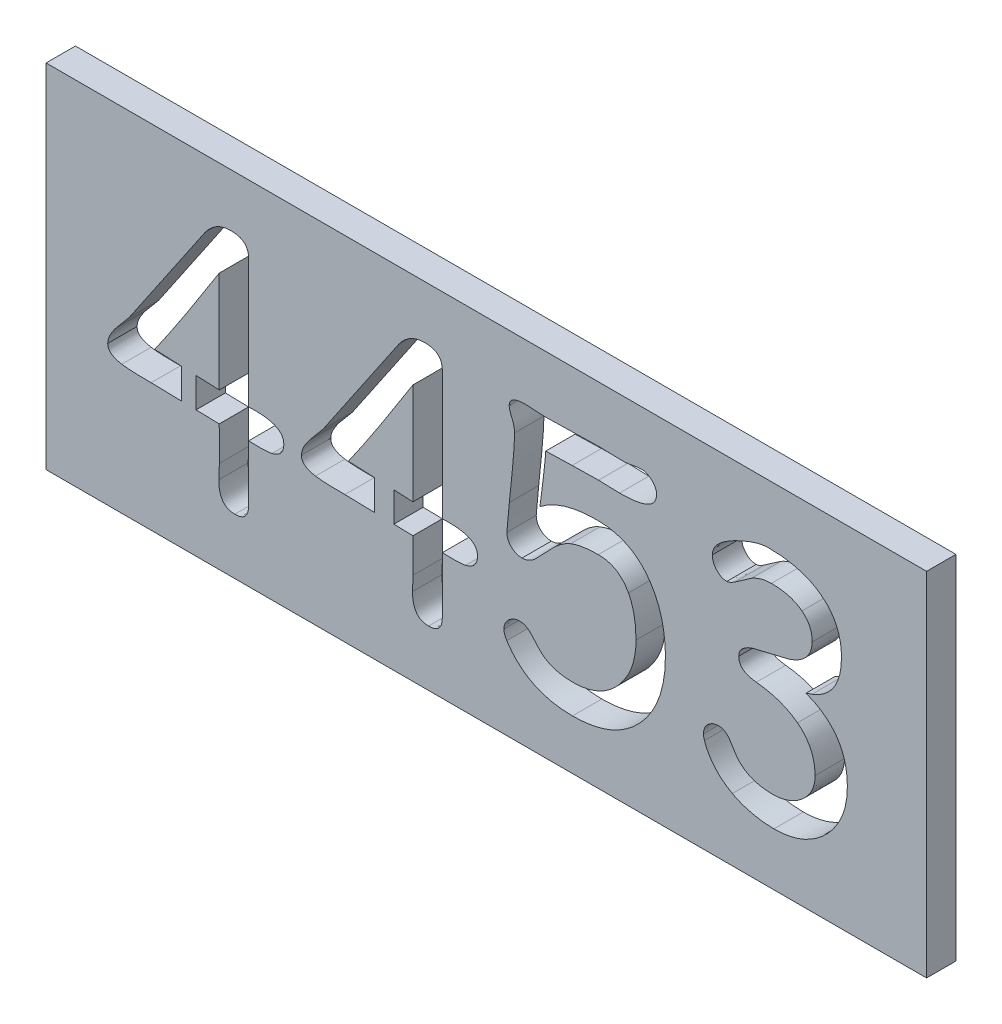
from build123d import *

# Parameters (mm, degrees)
SKETCH1_W           = 381
SKETCH1_H           = 152.4
BOSS_EXTRUDE1_DEPTH = 12.7
CUT_EXTRUDE1_DEPTH  = 206.567458514
SKETCH3_W           = 6.248362769
SKETCH3_H           = 26.243123629
SKETCH3_W_2         = 8.331150358
SKETCH3_H_2         = 23.952057281
BOSS_EXTRUDE2_DEPTH = 12.7


with BuildPart() as part:
    # Sketch1 → Boss-Extrude1 (new body)
    with BuildSketch(Plane.XY):
        Rectangle(SKETCH1_W, SKETCH1_H)
    extrude(amount=BOSS_EXTRUDE1_DEPTH)

    # Sketch2 → Cut-Extrude1 (cut, through all)
    # profile 1 of 4: a face of its own
    with BuildSketch(Plane.XY.offset(12.7)):
        with BuildLine():
            Line((-102.87, -21.59), (-102.87, -45.93828125))
            add(Edge.make_bspline(
                [(-102.87, -45.93828125), (-102.888344799, -46.416049339), (-102.923093354, -47.321033384), (-103.198056206, -48.585228637), (-103.653980481, -49.675352894), (-104.32141726, -50.568425378), (-105.184725762, -51.269670187), (-106.245057771, -51.742299275), (-107.479799736, -52.016543625), (-108.358597941, -52.051514579), (-108.823125, -52.07)],
                knots=[0, 0, 0, 0, 1.169846186, 2.215912189, 3.152384091, 4.043869571, 4.919746346, 5.848046681, 6.862491365, 8, 8, 8, 8], degree=3))
            add(Edge.make_bspline(
                [(-108.823125, -52.07), (-109.369634506, -52.050603363), (-110.411747987, -52.013616822), (-111.856935325, -51.534692006), (-113.097569763, -50.789237189), (-114.089982112, -49.707421831), (-114.877130788, -48.349951939), (-115.383900807, -46.687651711), (-115.735987805, -44.7558892), (-115.757129459, -43.367163204), (-115.7684375, -42.624375)],
                knots=[0, 0, 0, 0, 0.979258328, 1.867302019, 2.706068824, 3.55623654, 4.478688954, 5.505929839, 6.665996101, 8, 8, 8, 8], degree=3))
            add(Edge.make_bspline(
                [(-115.7684375, -42.624375), (-115.755752963, -42.154735109), (-115.725909429, -41.049790191), (-115.675365395, -39.613746124), (-115.586006208, -38.371727719), (-115.56195878, -37.550444767), (-115.502375478, -36.903438376), (-115.508042662, -36.532423173), (-115.51046875, -36.37359375)],
                knots=[0, 0, 0, 0, 1.351581217, 3.17993174, 4.133083147, 4.933198664, 5.543308631, 6, 6, 6, 6], degree=3))
            Line((-115.51046875, -36.37359375), (-115.57, -21.59))
            Line((-115.57, -21.59), (-145.03796875, -20.89546875))
            add(Edge.make_bspline(
                [(-145.03796875, -20.89546875), (-145.772229691, -20.899572244), (-147.181346594, -20.907447241), (-149.211738883, -20.853448163), (-151.064243465, -20.8239181), (-152.744490833, -20.762438299), (-154.239943117, -20.687405476), (-155.563053817, -20.586749163), (-156.709001538, -20.475577676), (-157.414193595, -20.368954122), (-157.73796875, -20.32)],
                knots=[0, 0, 0, 0, 1.384912504, 2.657779423, 3.830853642, 4.879563718, 5.829104526, 6.654925644, 7.382435391, 8, 8, 8, 8], degree=3))
            add(Edge.make_bspline(
                [(-157.73796875, -20.32), (-158.216195977, -20.22958258), (-159.116079712, -20.059443449), (-160.364446995, -19.684980451), (-161.421916196, -19.215300007), (-162.29436807, -18.654414545), (-162.988034143, -18.018906003), (-163.487780396, -17.28147435), (-163.7712078, -16.443708513), (-163.810116779, -15.857211187), (-163.83, -15.5575)],
                knots=[0, 0, 0, 0, 1.379706499, 2.596203994, 3.68766332, 4.650280589, 5.526184501, 6.337857579, 7.1506139, 8, 8, 8, 8], degree=3))
            add(Edge.make_bspline(
                [(-163.83, -15.5575), (-163.773638154, -15.016498201), (-163.650410699, -13.833671895), (-162.900097756, -11.99954138), (-161.738958862, -9.984005898), (-160.724740975, -8.640769858), (-160.17875, -7.91765625)],
                knots=[0, 0, 0, 0, 0.756102799, 1.65311517, 2.736585152, 4, 4, 4, 4], degree=3))
            Line((-160.17875, -7.91765625), (-154.44390625, -1.0715625))
            Line((-154.44390625, -1.0715625), (-121.70171875, 47.1090625))
            add(Edge.make_bspline(
                [(-121.70171875, 47.1090625), (-121.329799964, 47.608349325), (-120.608233302, 48.577025126), (-119.355010457, 49.836022956), (-118.04271514, 50.909252811), (-116.673005056, 51.822593898), (-115.204585433, 52.501380685), (-113.661314041, 52.973376218), (-112.050288449, 53.28567398), (-110.947859517, 53.321763354), (-110.39078125, 53.34)],
                knots=[0, 0, 0, 0, 1.10976452, 2.153075109, 3.1596165, 4.1319419, 5.082458473, 6.034439633, 7.006765033, 8, 8, 8, 8], degree=3))
            add(Edge.make_bspline(
                [(-110.39078125, 53.34), (-109.800277257, 53.32568963), (-108.688796431, 53.298753824), (-107.140763851, 52.977950971), (-105.818240538, 52.471041305), (-104.734627079, 51.736919473), (-103.862248789, 50.806955891), (-103.295532244, 49.628756332), (-102.924069476, 48.269343799), (-102.888729814, 47.290500143), (-102.87, 46.77171875)],
                knots=[0, 0, 0, 0, 1.238680683, 2.33151654, 3.304325217, 4.194636066, 5.060203577, 5.948886303, 6.912921778, 8, 8, 8, 8], degree=3))
            Line((-102.87, 46.77171875), (-102.87, -8.89))
            add(Edge.make_bspline(
                [(-102.87, -8.89), (-102.446705531, -8.875020337), (-101.520950652, -8.842259463), (-100.594638095, -8.834616841), (-100.091875, -8.83046875)],
                knots=[0, 0, 0, 0, 0.914484986, 2, 2, 2, 2], degree=3))
            add(Edge.make_bspline(
                [(-100.091875, -8.83046875), (-99.118903193, -8.84784629), (-97.293413328, -8.880450033), (-94.742391547, -9.158648091), (-92.58354894, -9.6695225), (-90.787732379, -10.344996089), (-89.374723378, -11.260445238), (-88.343028806, -12.409317421), (-87.740127662, -13.798668847), (-87.667300972, -14.791179164), (-87.63, -15.29953125)],
                knots=[0, 0, 0, 0, 1.491825352, 2.798962969, 3.925660001, 4.886213554, 5.727316361, 6.482038053, 7.222517784, 8, 8, 8, 8], degree=3))
            add(Edge.make_bspline(
                [(-87.63, -15.29953125), (-87.643329156, -15.678147566), (-87.668880028, -16.403923265), (-87.917142807, -17.436587198), (-88.306016668, -18.371718234), (-88.905232168, -19.169626771), (-89.631947128, -19.887265391), (-90.533449423, -20.471664568), (-91.586443824, -20.964158833), (-92.361638628, -21.166193328), (-92.76953125, -21.2725)],
                knots=[0, 0, 0, 0, 1.052635893, 2.017814653, 2.941857055, 3.852022768, 4.77698288, 5.773304414, 6.828355536, 8, 8, 8, 8], degree=3))
            add(Edge.make_bspline(
                [(-92.76953125, -21.2725), (-92.9870754, -21.323088092), (-93.477380031, -21.437104377), (-94.316372039, -21.518574225), (-95.321622268, -21.598158718), (-96.499442522, -21.66092765), (-97.849522235, -21.671479253), (-99.370897701, -21.671549432), (-101.064682916, -21.656431245), (-102.248303872, -21.612876894), (-102.87, -21.59)],
                knots=[0, 0, 0, 0, 0.528828037, 1.191881445, 1.993827588, 2.919923687, 3.986026796, 5.193101272, 6.525678293, 8, 8, 8, 8], degree=3))
        make_face()
        with BuildLine():
            add(Edge.make_bspline(
                [(-115.57, 34.925), (-117.015769873, 32.627950693), (-119.816232346, 28.178556289), (-123.929477854, 21.745987828), (-127.794073342, 15.760797923), (-131.407695029, 10.214686155), (-134.776224463, 5.122407587), (-137.895807829, 0.470560141), (-140.761524522, -3.738156089), (-142.626634956, -6.37236827), (-143.51, -7.62)],
                knots=[0, 0, 0, 0, 1.279636809, 2.478662012, 3.599736217, 4.638573139, 5.599520427, 6.478296641, 7.279281522, 8, 8, 8, 8], degree=3))
            Line((-143.51, -7.62), (-115.57, -8.89))
            Line((-115.57, -8.89), (-115.57, 34.925))
        make_face(mode=Mode.SUBTRACT)
    # profile 2 of 4: a face of its own
    with BuildSketch(Plane.XY.offset(12.7)):
        with BuildLine():
            Line((-19.05, -21.59), (-19.05, -45.93828125))
            add(Edge.make_bspline(
                [(-19.05, -45.93828125), (-19.068344799, -46.416049339), (-19.103093354, -47.321033384), (-19.378056206, -48.585228637), (-19.833980481, -49.675352894), (-20.50141726, -50.568425378), (-21.364725762, -51.269670187), (-22.425057771, -51.742299275), (-23.659799736, -52.016543625), (-24.538597941, -52.051514579), (-25.003125, -52.07)],
                knots=[0, 0, 0, 0, 1.169846186, 2.215912189, 3.152384091, 4.043869571, 4.919746346, 5.848046681, 6.862491365, 8, 8, 8, 8], degree=3))
            add(Edge.make_bspline(
                [(-25.003125, -52.07), (-25.549634506, -52.050603363), (-26.591747987, -52.013616822), (-28.036935325, -51.534692006), (-29.277569763, -50.789237189), (-30.269982112, -49.707421831), (-31.057130788, -48.349951939), (-31.563900807, -46.687651711), (-31.915987805, -44.7558892), (-31.937129459, -43.367163204), (-31.9484375, -42.624375)],
                knots=[0, 0, 0, 0, 0.979258328, 1.867302019, 2.706068824, 3.55623654, 4.478688954, 5.505929839, 6.665996101, 8, 8, 8, 8], degree=3))
            add(Edge.make_bspline(
                [(-31.9484375, -42.624375), (-31.935752963, -42.154735109), (-31.905909429, -41.049790191), (-31.855365395, -39.613746124), (-31.766006208, -38.371727719), (-31.74195878, -37.550444767), (-31.682375478, -36.903438376), (-31.688042662, -36.532423173), (-31.69046875, -36.37359375)],
                knots=[0, 0, 0, 0, 1.351581217, 3.17993174, 4.133083147, 4.933198664, 5.543308631, 6, 6, 6, 6], degree=3))
            Line((-31.69046875, -36.37359375), (-31.75, -21.59))
            Line((-31.75, -21.59), (-61.21796875, -20.89546875))
            add(Edge.make_bspline(
                [(-61.21796875, -20.89546875), (-61.952229691, -20.899572244), (-63.361346594, -20.907447241), (-65.391738883, -20.853448163), (-67.244243465, -20.8239181), (-68.924490833, -20.762438299), (-70.419943117, -20.687405476), (-71.743053817, -20.586749163), (-72.889001538, -20.475577676), (-73.594193595, -20.368954122), (-73.91796875, -20.32)],
                knots=[0, 0, 0, 0, 1.384912504, 2.657779423, 3.830853642, 4.879563718, 5.829104526, 6.654925644, 7.382435391, 8, 8, 8, 8], degree=3))
            add(Edge.make_bspline(
                [(-73.91796875, -20.32), (-74.396195977, -20.22958258), (-75.296079712, -20.059443449), (-76.544446995, -19.684980451), (-77.601916196, -19.215300007), (-78.47436807, -18.654414545), (-79.168034143, -18.018906003), (-79.667780396, -17.28147435), (-79.9512078, -16.443708513), (-79.990116779, -15.857211187), (-80.01, -15.5575)],
                knots=[0, 0, 0, 0, 1.379706499, 2.596203994, 3.68766332, 4.650280589, 5.526184501, 6.337857579, 7.1506139, 8, 8, 8, 8], degree=3))
            add(Edge.make_bspline(
                [(-80.01, -15.5575), (-79.953638154, -15.016498201), (-79.830410699, -13.833671895), (-79.080097756, -11.99954138), (-77.918958862, -9.984005898), (-76.904740975, -8.640769858), (-76.35875, -7.91765625)],
                knots=[0, 0, 0, 0, 0.756102799, 1.65311517, 2.736585152, 4, 4, 4, 4], degree=3))
            Line((-76.35875, -7.91765625), (-70.62390625, -1.0715625))
            Line((-70.62390625, -1.0715625), (-37.88171875, 47.1090625))
            add(Edge.make_bspline(
                [(-37.88171875, 47.1090625), (-37.509799964, 47.608349325), (-36.788233302, 48.577025126), (-35.535010457, 49.836022956), (-34.22271514, 50.909252811), (-32.853005056, 51.822593898), (-31.384585433, 52.501380685), (-29.841314041, 52.973376218), (-28.230288449, 53.28567398), (-27.127859517, 53.321763354), (-26.57078125, 53.34)],
                knots=[0, 0, 0, 0, 1.10976452, 2.153075109, 3.1596165, 4.1319419, 5.082458473, 6.034439633, 7.006765033, 8, 8, 8, 8], degree=3))
            add(Edge.make_bspline(
                [(-26.57078125, 53.34), (-25.980277257, 53.32568963), (-24.868796431, 53.298753824), (-23.320763851, 52.977950971), (-21.998240538, 52.471041305), (-20.914627079, 51.736919473), (-20.042248789, 50.806955891), (-19.475532244, 49.628756332), (-19.104069476, 48.269343799), (-19.068729814, 47.290500143), (-19.05, 46.77171875)],
                knots=[0, 0, 0, 0, 1.238680683, 2.33151654, 3.304325217, 4.194636066, 5.060203577, 5.948886303, 6.912921778, 8, 8, 8, 8], degree=3))
            Line((-19.05, 46.77171875), (-19.05, -8.89))
            add(Edge.make_bspline(
                [(-19.05, -8.89), (-18.626705531, -8.875020337), (-17.700950652, -8.842259463), (-16.774638095, -8.834616841), (-16.271875, -8.83046875)],
                knots=[0, 0, 0, 0, 0.914484986, 2, 2, 2, 2], degree=3))
            add(Edge.make_bspline(
                [(-16.271875, -8.83046875), (-15.298903193, -8.84784629), (-13.473413328, -8.880450033), (-10.922391547, -9.158648091), (-8.76354894, -9.6695225), (-6.967732379, -10.344996089), (-5.554723378, -11.260445238), (-4.523028806, -12.409317421), (-3.920127662, -13.798668847), (-3.847300972, -14.791179164), (-3.81, -15.29953125)],
                knots=[0, 0, 0, 0, 1.491825352, 2.798962969, 3.925660001, 4.886213554, 5.727316361, 6.482038053, 7.222517784, 8, 8, 8, 8], degree=3))
            add(Edge.make_bspline(
                [(-3.81, -15.29953125), (-3.823329156, -15.678147566), (-3.848880028, -16.403923265), (-4.097142807, -17.436587198), (-4.486016668, -18.371718234), (-5.085232168, -19.169626771), (-5.811947128, -19.887265391), (-6.713449423, -20.471664568), (-7.766443824, -20.964158833), (-8.541638628, -21.166193328), (-8.94953125, -21.2725)],
                knots=[0, 0, 0, 0, 1.052635893, 2.017814653, 2.941857055, 3.852022768, 4.77698288, 5.773304414, 6.828355536, 8, 8, 8, 8], degree=3))
            add(Edge.make_bspline(
                [(-8.94953125, -21.2725), (-9.1670754, -21.323088092), (-9.657380031, -21.437104377), (-10.496372039, -21.518574225), (-11.501622268, -21.598158718), (-12.679442522, -21.66092765), (-14.029522235, -21.671479253), (-15.550897701, -21.671549432), (-17.244682916, -21.656431245), (-18.428303872, -21.612876894), (-19.05, -21.59)],
                knots=[0, 0, 0, 0, 0.528828037, 1.191881445, 1.993827588, 2.919923687, 3.986026796, 5.193101272, 6.525678293, 8, 8, 8, 8], degree=3))
        make_face()
        with BuildLine():
            add(Edge.make_bspline(
                [(-31.75, 34.925), (-33.195769873, 32.627950693), (-35.996232346, 28.178556289), (-40.109477854, 21.745987828), (-43.974073342, 15.760797923), (-47.587695029, 10.214686155), (-50.956224463, 5.122407587), (-54.075807829, 0.470560141), (-56.941524522, -3.738156089), (-58.806634956, -6.37236827), (-59.69, -7.62)],
                knots=[0, 0, 0, 0, 1.279636809, 2.478662012, 3.599736217, 4.638573139, 5.599520427, 6.478296641, 7.279281522, 8, 8, 8, 8], degree=3))
            Line((-59.69, -7.62), (-31.75, -8.89))
            Line((-31.75, -8.89), (-31.75, 34.925))
        make_face(mode=Mode.SUBTRACT)
    # profile 3 of 4: a face of its own
    with BuildSketch(Plane.XY.offset(12.7)):
        with BuildLine():
            add(Edge.make_bspline(
                [(37.2665625, -54.61), (35.709665323, -54.570887534), (32.687097744, -54.494954406), (28.313463266, -53.828393545), (24.252178061, -52.746241601), (20.507972521, -51.2099391), (17.071305828, -49.235185603), (13.986098159, -46.782290706), (11.177714954, -43.931770166), (9.634209622, -41.735547623), (8.8503125, -40.62015625)],
                knots=[0, 0, 0, 0, 1.127419806, 2.18877817, 3.196685602, 4.165841351, 5.112751059, 6.058046526, 7.013743776, 8, 8, 8, 8], degree=3))
            add(Edge.make_bspline(
                [(8.8503125, -40.62015625), (8.662967536, -40.30037864), (8.305862161, -39.690838353), (7.925099642, -38.735261811), (7.668031768, -37.802655326), (7.635745273, -37.175523285), (7.62, -36.8696875)],
                knots=[0, 0, 0, 0, 1.111575613, 2.11881663, 3.082596397, 4, 4, 4, 4], degree=3))
            add(Edge.make_bspline(
                [(7.62, -36.8696875), (7.647413569, -36.449722502), (7.701769298, -35.61701428), (8.118450184, -34.422587741), (8.794949017, -33.320263618), (9.72615417, -32.351309176), (10.812328613, -31.531679317), (11.999668677, -30.924337001), (13.259091188, -30.544902004), (14.1261233, -30.501821922), (14.5653125, -30.48)],
                knots=[0, 0, 0, 0, 0.966618571, 1.916615038, 2.881668624, 3.928109061, 4.995560701, 6.004899098, 6.989395252, 8, 8, 8, 8], degree=3))
            add(Edge.make_bspline(
                [(14.5653125, -30.48), (15.033567672, -30.514732388), (15.995877602, -30.586110824), (17.392396432, -31.187099237), (18.724597732, -32.153980888), (19.507176575, -32.991545071), (19.923125, -33.43671875)],
                knots=[0, 0, 0, 0, 0.887780184, 1.824474644, 2.843686674, 4, 4, 4, 4], degree=3))
            add(Edge.make_bspline(
                [(19.923125, -33.43671875), (20.484773751, -34.098291639), (21.51296437, -35.309409864), (23.012464177, -36.867260538), (24.236640215, -38.104574843), (25.062405826, -38.696892685), (25.41984375, -38.95328125)],
                knots=[0, 0, 0, 0, 1.333140834, 2.440534046, 3.324975191, 4, 4, 4, 4], degree=3))
            add(Edge.make_bspline(
                [(25.41984375, -38.95328125), (26.219801579, -39.413023356), (27.885310107, -40.370204311), (30.780401558, -41.265257191), (34.042632857, -41.82781408), (36.35099388, -41.881686052), (37.56421875, -41.91)],
                knots=[0, 0, 0, 0, 0.871871525, 1.815232511, 2.851733232, 4, 4, 4, 4], degree=3))
            add(Edge.make_bspline(
                [(37.56421875, -41.91), (38.538220485, -41.884788333), (40.449158917, -41.835324414), (43.248381156, -41.401767971), (45.924515234, -40.721311091), (48.455667822, -39.70607183), (50.884055966, -38.458945866), (53.159133806, -36.894595273), (55.337451918, -35.082833822), (56.629639586, -33.677474789), (57.28890625, -32.96046875)],
                knots=[0, 0, 0, 0, 1.044267921, 2.048796869, 3.031536308, 4.000031644, 4.968032963, 5.954045993, 6.956166115, 8, 8, 8, 8], degree=3))
            add(Edge.make_bspline(
                [(57.28890625, -32.96046875), (57.884843056, -32.2433899), (59.069784213, -30.817573884), (60.590902733, -28.506516007), (61.895599134, -26.093226315), (62.945356091, -23.564984936), (63.764903885, -20.934571737), (64.3324728, -18.195940962), (64.706091042, -15.349503278), (64.7484566, -13.408971446), (64.77, -12.4221875)],
                knots=[0, 0, 0, 0, 1.000334131, 1.989031506, 2.96440375, 3.941635423, 4.923166374, 5.917585056, 6.941066772, 8, 8, 8, 8], degree=3))
            add(Edge.make_bspline(
                [(64.77, -12.4221875), (64.755453904, -11.615078224), (64.727175097, -10.045991444), (64.597583385, -7.746504199), (64.336619318, -5.567830096), (63.981390256, -3.500846021), (63.531461681, -1.541450569), (62.950252837, 0.288906106), (62.306323917, 2.024303552), (61.763762136, 3.100067405), (61.49578125, 3.63140625)],
                knots=[0, 0, 0, 0, 1.171102166, 2.276718882, 3.339657713, 4.352510401, 5.318500579, 6.253339523, 7.137293416, 8, 8, 8, 8], degree=3))
            add(Edge.make_bspline(
                [(61.49578125, 3.63140625), (61.13317987, 4.249234697), (60.427331063, 5.451914822), (59.151347783, 7.061191692), (57.700111957, 8.391098089), (56.146689113, 9.532370584), (54.419855668, 10.389913552), (52.543114999, 10.977039026), (50.538619024, 11.371948022), (49.148307353, 11.410381056), (48.43859375, 11.43)],
                knots=[0, 0, 0, 0, 1.070413406, 2.083693192, 3.056436075, 4.006128401, 4.957107399, 5.923595284, 6.940055885, 8, 8, 8, 8], degree=3))
            add(Edge.make_bspline(
                [(48.43859375, 11.43), (47.273130205, 11.410553916), (45.055241923, 11.373547832), (41.890595116, 11.004617905), (39.043610009, 10.453555358), (37.313418557, 9.823760115), (36.49265625, 9.525)],
                knots=[0, 0, 0, 0, 1.148921396, 2.186408414, 3.139674623, 4, 4, 4, 4], degree=3))
            add(Edge.make_bspline(
                [(36.49265625, 9.525), (35.870174836, 9.24806441), (34.579409716, 8.673816259), (32.719177444, 7.497902739), (30.842437759, 6.066961184), (29.662708649, 4.946410972), (29.05125, 4.365625)],
                knots=[0, 0, 0, 0, 0.896298641, 1.858547096, 2.890075791, 4, 4, 4, 4], degree=3))
            Line((29.05125, 4.365625), (21.59, -3.413125))
            add(Edge.make_bspline(
                [(21.59, -3.413125), (21.102089289, -3.862577039), (20.176574196, -4.715140093), (18.617213327, -5.637642952), (17.043770768, -6.24775939), (15.966110444, -6.316393518), (15.4384375, -6.35)],
                knots=[0, 0, 0, 0, 1.136151499, 2.155159412, 3.096679684, 4, 4, 4, 4], degree=3))
            add(Edge.make_bspline(
                [(15.4384375, -6.35), (14.999074925, -6.328819836), (14.138063269, -6.287313415), (12.906886341, -5.908890292), (11.770191154, -5.327057184), (10.76618441, -4.514871741), (9.942419108, -3.534070445), (9.327258922, -2.439582575), (8.954009971, -1.240891099), (8.911627801, -0.406135545), (8.89, 0.01984375)],
                knots=[0, 0, 0, 0, 1.036694507, 2.031593279, 3.018094046, 4.041723946, 5.063200093, 6.029526426, 6.994458989, 8, 8, 8, 8], degree=3))
            add(Edge.make_bspline(
                [(8.89, 0.01984375), (8.896585916, 0.178585867), (8.913604914, 0.588799352), (8.946004399, 1.344531667), (9.06481906, 2.380449883), (9.174051859, 3.697568582), (9.314502844, 5.305392263), (9.491002533, 7.190787147), (9.712490061, 9.366700509), (9.875039401, 10.907504455), (9.9615625, 11.72765625)],
                knots=[0, 0, 0, 0, 0.324309244, 0.838063818, 1.543362689, 2.451561047, 3.535781534, 4.837577244, 6.316679611, 8, 8, 8, 8], degree=3))
            add(Edge.make_bspline(
                [(9.9615625, 11.72765625), (10.141899309, 13.381107201), (10.485868768, 16.53485397), (10.950299239, 21.045409169), (11.308312822, 25.109775096), (11.672690561, 28.723949791), (11.896297533, 31.901461654), (12.08732088, 34.63890306), (12.188637834, 36.935097232), (12.212940208, 38.318219312), (12.22375, 38.9334375)],
                knots=[0, 0, 0, 0, 1.461772076, 2.788143768, 3.98497447, 5.047597539, 5.980335212, 6.7842726, 7.45923963, 8, 8, 8, 8], degree=3))
            add(Edge.make_bspline(
                [(12.22375, 38.9334375), (12.206324461, 39.32467007), (12.170343964, 40.132492583), (11.93513944, 41.367228648), (11.586981441, 42.661436067), (11.06437692, 43.938765713), (10.539327851, 45.152602444), (10.194674111, 46.259284766), (9.945459004, 47.184570213), (9.901728906, 47.74955838), (9.8821875, 48.00203125)],
                knots=[0, 0, 0, 0, 0.996329814, 2.057235815, 3.193588856, 4.40443921, 5.568312033, 6.559356999, 7.356228512, 8, 8, 8, 8], degree=3))
            add(Edge.make_bspline(
                [(9.8821875, 48.00203125), (9.906418948, 48.315544705), (9.953158349, 48.920272544), (10.279942239, 49.777858509), (10.866506639, 50.488859623), (11.663569051, 51.072340545), (12.687944219, 51.509327156), (13.926233376, 51.777970171), (15.371710919, 51.992146461), (16.40975844, 52.004073132), (16.96640625, 52.01046875)],
                knots=[0, 0, 0, 0, 0.824070621, 1.589528096, 2.369082137, 3.214353596, 4.164423734, 5.273854239, 6.538117923, 8, 8, 8, 8], degree=3))
            add(Edge.make_bspline(
                [(16.96640625, 52.01046875), (17.217771439, 52.00442697), (17.78020934, 51.990908289), (18.713620581, 51.954184233), (19.817473952, 51.866839933), (21.041058713, 51.773712169), (22.263601145, 51.669733044), (23.375750071, 51.61619543), (24.308318738, 51.572566506), (24.870802027, 51.559777965), (25.1221875, 51.5540625)],
                knots=[0, 0, 0, 0, 0.738619002, 1.652684381, 2.743571108, 3.990919754, 5.257640893, 6.347315619, 7.261380998, 8, 8, 8, 8], degree=3))
            add(Edge.make_bspline(
                [(25.1221875, 51.5540625), (25.856411885, 51.560013144), (27.483673622, 51.573201559), (30.169427482, 51.611118515), (33.344501565, 51.693360684), (36.84984375, 51.81203125), (40.355185935, 51.930701816), (43.530260018, 52.012943985), (46.216013878, 52.050860941), (47.843275615, 52.064049356), (48.5775, 52.07)],
                knots=[0, 0, 0, 0, 0.751087817, 1.664636167, 2.747579601, 4, 5.252420399, 6.335363833, 7.248912183, 8, 8, 8, 8], degree=3))
            add(Edge.make_bspline(
                [(48.5775, 52.07), (48.921502277, 52.072702983), (49.689098654, 52.078734337), (50.951947725, 52.022184575), (52.45389129, 51.992503515), (54.113957003, 51.933632107), (55.773601058, 51.860287341), (57.276120105, 51.866006037), (58.53208048, 51.802393473), (59.293075613, 51.809070803), (59.63046875, 51.81203125)],
                knots=[0, 0, 0, 0, 0.746592698, 1.665924583, 2.743123774, 4.00732232, 5.271520865, 6.348432969, 7.267764854, 8, 8, 8, 8], degree=3))
            add(Edge.make_bspline(
                [(59.63046875, 51.81203125), (59.86866428, 51.823867255), (60.392159532, 51.849879887), (61.255011068, 51.926178132), (62.253175933, 52.091728961), (63.341200083, 52.308421053), (64.423104009, 52.522136445), (65.40754771, 52.690046736), (66.250641534, 52.766207007), (66.760920106, 52.792352935), (66.9925, 52.80421875)],
                knots=[0, 0, 0, 0, 0.769489407, 1.69114866, 2.792889823, 4.0318174, 5.270744977, 6.351407224, 7.251818594, 8, 8, 8, 8], degree=3))
            add(Edge.make_bspline(
                [(66.9925, 52.80421875), (67.41798917, 52.780978347), (68.264464304, 52.734743508), (69.496213804, 52.37234129), (70.622368324, 51.725593884), (71.659185646, 50.908465264), (72.53934557, 49.939561437), (73.203247388, 48.861918685), (73.595694709, 47.691225394), (73.638534366, 46.880361469), (73.66, 46.4740625)],
                knots=[0, 0, 0, 0, 1.006312599, 2.001974793, 3.004016356, 4.062668678, 5.115750329, 6.084969874, 7.040437314, 8, 8, 8, 8], degree=3))
            add(Edge.make_bspline(
                [(73.66, 46.4740625), (73.610600687, 45.890214046), (73.513732638, 44.745334554), (72.724588475, 43.151389406), (71.398217404, 41.845151732), (69.571638962, 40.834294712), (67.286945749, 40.023818918), (64.507342387, 39.478480573), (61.238974625, 39.153851711), (58.897125136, 39.113658811), (57.64609375, 39.0921875)],
                knots=[0, 0, 0, 0, 0.716953537, 1.405887771, 2.137833422, 2.977953025, 3.957692424, 5.114985765, 6.458806437, 8, 8, 8, 8], degree=3))
            add(Edge.make_bspline(
                [(57.64609375, 39.0921875), (56.85890137, 39.102822076), (55.105480199, 39.126509919), (52.876506944, 39.205753545), (51.064891423, 39.292455588), (49.946252813, 39.317159309), (49.140224609, 39.376376598), (48.703221717, 39.371750875), (48.5378125, 39.37)],
                knots=[0, 0, 0, 0, 1.554930613, 3.463509465, 4.404991172, 5.137086353, 5.673380031, 6, 6, 6, 6], degree=3))
            Line((48.5378125, 39.37), (37.1078125, 39.1715625))
            Line((37.1078125, 39.1715625), (25.69765625, 38.8540625))
            add(Edge.make_bspline(
                [(25.69765625, 38.8540625), (25.686945916, 38.523191409), (25.660131632, 37.694825869), (25.525858927, 36.200200196), (25.322554699, 34.203902008), (25.07656728, 31.700646507), (24.697574042, 28.701600556), (24.300734727, 25.191844696), (23.764941895, 21.18088065), (23.406975746, 18.335877633), (23.2171875, 16.8275)],
                knots=[0, 0, 0, 0, 0.358306286, 0.897052017, 1.623788493, 2.530788156, 3.619663429, 4.89594316, 6.354275943, 8, 8, 8, 8], degree=3))
            add(Edge.make_bspline(
                [(23.2171875, 16.8275), (24.013023449, 17.413124045), (25.618313082, 18.594392884), (28.252784575, 20.071876601), (31.076188556, 21.331623036), (34.091830061, 22.360204895), (37.301146869, 23.145660807), (40.695169023, 23.726466385), (44.284582243, 24.05910322), (46.744584654, 24.106018793), (48.00203125, 24.13)],
                knots=[0, 0, 0, 0, 0.900264753, 1.815934146, 2.747378352, 3.716302609, 4.716866347, 5.757003088, 6.853477208, 8, 8, 8, 8], degree=3))
            add(Edge.make_bspline(
                [(48.00203125, 24.13), (49.214559954, 24.097672182), (51.572759154, 24.034799086), (55.004707317, 23.488640734), (58.211970093, 22.581135609), (61.200096868, 21.299975397), (63.963822914, 19.66027591), (66.498210702, 17.653062925), (68.836033282, 15.298596386), (70.150982835, 13.48635307), (70.82234375, 12.56109375)],
                knots=[0, 0, 0, 0, 1.088825706, 2.117614124, 3.112672284, 4.076358835, 5.030303208, 5.990906541, 6.97423683, 8, 8, 8, 8], degree=3))
            add(Edge.make_bspline(
                [(70.82234375, 12.56109375), (71.360927898, 11.723791589), (72.443956012, 10.040077386), (73.790188357, 7.316969443), (74.916758904, 4.431283568), (75.851238118, 1.379960769), (76.587046562, -1.835712914), (77.091057975, -5.226068487), (77.421633013, -8.777582443), (77.453663622, -11.204331257), (77.47, -12.44203125)],
                knots=[0, 0, 0, 0, 0.909370279, 1.828634543, 2.770561304, 3.738213024, 4.742836353, 5.782555833, 6.869050388, 8, 8, 8, 8], degree=3))
            add(Edge.make_bspline(
                [(77.47, -12.44203125), (77.444999185, -13.925466441), (77.396064078, -16.829054191), (76.850724992, -21.081107644), (76.036788191, -25.136089274), (74.859383565, -28.999801411), (73.329556427, -32.652807015), (71.46470661, -36.111165382), (69.296879548, -39.390148503), (67.577396033, -41.372040646), (66.7146875, -42.36640625)],
                knots=[0, 0, 0, 0, 1.092706949, 2.138799546, 3.154167993, 4.138034315, 5.110420032, 6.067941995, 7.030637448, 8, 8, 8, 8], degree=3))
            add(Edge.make_bspline(
                [(66.7146875, -42.36640625), (65.770544412, -43.348598568), (63.905592133, -45.288708945), (60.748615552, -47.778333528), (57.381359288, -49.892059182), (53.790969035, -51.632028753), (49.972470603, -52.960971166), (45.936400743, -53.911247754), (41.675805917, -54.497662994), (38.756746715, -54.57203366), (37.2665625, -54.61)],
                knots=[0, 0, 0, 0, 0.993406227, 1.962261049, 2.925361287, 3.890540508, 4.867731162, 5.870094698, 6.912680065, 8, 8, 8, 8], degree=3))
        make_face()
    # profile 4 of 4: a face of its own
    with BuildSketch(Plane.XY.offset(12.7)):
        with BuildLine():
            add(Edge.make_bspline(
                [(124.46, -53.34), (123.632758843, -53.330433812), (122.002249527, -53.311578658), (119.590221647, -53.10587559), (117.2437728, -52.772252469), (114.95959847, -52.291361055), (112.734441123, -51.693778815), (110.563815131, -50.992023327), (108.476361926, -50.108900597), (107.132772986, -49.43167646), (106.46171875, -49.0934375)],
                knots=[0, 0, 0, 0, 1.062637129, 2.094479614, 3.107674083, 4.106075549, 5.091479239, 6.067048719, 7.034589296, 8, 8, 8, 8], degree=3))
            add(Edge.make_bspline(
                [(106.46171875, -49.0934375), (105.739336126, -48.675991428), (104.310778881, -47.850465465), (102.342023626, -46.416318993), (100.528317595, -44.891381556), (98.944108335, -43.201214257), (97.494259801, -41.422217821), (96.278394807, -39.484147314), (95.198911787, -37.44902879), (94.652920926, -36.009828551), (94.376875, -35.2821875)],
                knots=[0, 0, 0, 0, 1.065310314, 2.106718403, 3.107734835, 4.088095411, 5.062170155, 6.035107667, 7.006575817, 8, 8, 8, 8], degree=3))
            add(Edge.make_bspline(
                [(94.376875, -35.2821875), (94.261150993, -34.888069107), (94.036497982, -34.122973899), (93.998449043, -33.326713223), (93.98, -32.940625)],
                knots=[0, 0, 0, 0, 1.030246665, 2, 2, 2, 2], degree=3))
            add(Edge.make_bspline(
                [(93.98, -32.940625), (94.000246338, -32.507749877), (94.040013276, -31.657516235), (94.431584864, -30.450213846), (95.068650348, -29.361230737), (95.938189322, -28.426542718), (96.972149954, -27.657806883), (98.098034382, -27.066464335), (99.32742997, -26.74626106), (100.162976112, -26.695711537), (100.58796875, -26.67)],
                knots=[0, 0, 0, 0, 1.023824357, 2.010949267, 2.973980484, 3.995278807, 5.014768987, 6.017839224, 6.991792679, 8, 8, 8, 8], degree=3))
            add(Edge.make_bspline(
                [(100.58796875, -26.67), (101.016397155, -26.69907016), (101.86791686, -26.75684834), (103.078760892, -27.277806946), (104.197832119, -28.086247407), (104.797632948, -28.823283126), (105.11234375, -29.21)],
                knots=[0, 0, 0, 0, 0.951041816, 1.890236123, 2.893023402, 4, 4, 4, 4], degree=3))
            Line((105.11234375, -29.21), (108.12859375, -33.9328125))
            add(Edge.make_bspline(
                [(108.12859375, -33.9328125), (108.543940408, -34.468265367), (109.373043267, -35.537120729), (110.882423231, -36.912639856), (112.59114601, -38.070282313), (114.494701387, -39.034321765), (116.606761736, -39.759286843), (118.917037277, -40.268861552), (121.414712419, -40.592834227), (123.14926605, -40.623958222), (124.04328125, -40.64)],
                knots=[0, 0, 0, 0, 0.903506741, 1.803553747, 2.71235414, 3.652373549, 4.643918613, 5.685190286, 6.80691203, 8, 8, 8, 8], degree=3))
            add(Edge.make_bspline(
                [(124.04328125, -40.64), (124.625762428, -40.621251354), (125.780730863, -40.584075743), (127.490301668, -40.393673259), (129.142073079, -40.029542292), (130.736867916, -39.534578237), (132.275438266, -38.891643048), (133.763854623, -38.118069512), (135.202290678, -37.206080774), (136.094625429, -36.494493028), (136.54484375, -36.13546875)],
                knots=[0, 0, 0, 0, 1.030634857, 2.043586597, 3.037233154, 4.017844988, 4.993418681, 5.982439587, 6.982060644, 8, 8, 8, 8], degree=3))
            add(Edge.make_bspline(
                [(136.54484375, -36.13546875), (136.994957982, -35.73270249), (137.877921351, -34.942618932), (139.06024495, -33.654395656), (140.035920916, -32.274827495), (140.83070915, -30.833576437), (141.483281285, -29.345316178), (141.907517988, -27.772575911), (142.206932417, -26.145671067), (142.228894489, -25.030997945), (142.24, -24.46734375)],
                knots=[0, 0, 0, 0, 1.078818141, 2.116255903, 3.11640491, 4.089802955, 5.053467135, 6.011243513, 6.99435008, 8, 8, 8, 8], degree=3))
            add(Edge.make_bspline(
                [(142.24, -24.46734375), (142.218455637, -23.652350352), (142.17637427, -22.060470601), (141.808256001, -19.737625333), (141.214959105, -17.539516011), (140.376379761, -15.460321232), (139.299658385, -13.510936732), (137.994410357, -11.681495024), (136.44488548, -9.983626745), (135.247875333, -8.995203218), (134.63984375, -8.493125)],
                knots=[0, 0, 0, 0, 1.065167395, 2.080530235, 3.066737807, 4.036883539, 5.004712962, 5.972001115, 6.969860553, 8, 8, 8, 8], degree=3))
            add(Edge.make_bspline(
                [(134.63984375, -8.493125), (134.065338096, -8.071564022), (132.904986283, -7.220120625), (130.999712199, -6.138714721), (128.971611301, -5.162133516), (126.801209222, -4.311990754), (124.502814422, -3.575899789), (122.060802133, -2.985802273), (119.491804354, -2.502516063), (117.721361078, -2.303805466), (116.82015625, -2.20265625)],
                knots=[0, 0, 0, 0, 0.892968589, 1.803564011, 2.742253014, 3.714255124, 4.724273535, 5.766448113, 6.863060019, 8, 8, 8, 8], degree=3))
            add(Edge.make_bspline(
                [(116.82015625, -2.20265625), (116.222741132, -2.129630573), (115.096307082, -1.9919397), (113.53909375, -1.602699852), (112.219458144, -1.06436613), (111.125407913, -0.393403863), (110.263746937, 0.435772264), (109.646787823, 1.421338573), (109.283446329, 2.555079544), (109.241548673, 3.357575344), (109.22, 3.7703125)],
                knots=[0, 0, 0, 0, 1.342042323, 2.530438426, 3.569204404, 4.510971691, 5.377203902, 6.212587549, 7.080703559, 8, 8, 8, 8], degree=3))
            add(Edge.make_bspline(
                [(109.22, 3.7703125), (109.238894172, 4.090248058), (109.275865774, 4.71628928), (109.577042463, 5.617620233), (110.035399556, 6.467435437), (110.710116772, 7.24219998), (111.554590072, 7.961044613), (112.588481713, 8.614188991), (113.792203384, 9.233462828), (114.685879903, 9.555177603), (115.15328125, 9.7234375)],
                knots=[0, 0, 0, 0, 0.852417, 1.667986467, 2.513789787, 3.416165944, 4.393241327, 5.466193938, 6.674795254, 8, 8, 8, 8], degree=3))
            Line((115.15328125, 9.7234375), (131.42515625, 13.63265625))
            add(Edge.make_bspline(
                [(131.42515625, 13.63265625), (132.166516393, 13.920785846), (133.589886652, 14.473978651), (135.526423273, 15.527944062), (137.17746242, 16.719420738), (138.538820602, 18.067311634), (139.599989116, 19.574492174), (140.398347081, 21.223777257), (140.85567901, 23.047857432), (140.93116695, 24.312744951), (140.97, 24.9634375)],
                knots=[0, 0, 0, 0, 1.200052421, 2.304033931, 3.318846265, 4.265195727, 5.182426333, 6.089321462, 7.017094983, 8, 8, 8, 8], degree=3))
            add(Edge.make_bspline(
                [(140.97, 24.9634375), (140.966834527, 25.44017858), (140.960654531, 26.37092651), (140.781467185, 27.738072406), (140.442069982, 29.029119488), (139.963997327, 30.248753708), (139.342215766, 31.399070389), (138.556164491, 32.467466851), (137.647719683, 33.496647441), (136.930654678, 34.087610166), (136.5646875, 34.38921875)],
                knots=[0, 0, 0, 0, 1.057048992, 2.06369076, 3.049688478, 4.011694542, 4.963912089, 5.941464041, 6.9493887, 8, 8, 8, 8], degree=3))
            add(Edge.make_bspline(
                [(136.5646875, 34.38921875), (136.161381322, 34.690695196), (135.340204513, 35.304535201), (133.962755944, 36.040705086), (132.485233823, 36.686384752), (130.879933209, 37.194853987), (129.165470871, 37.6185892), (127.317054587, 37.881094528), (125.363482097, 38.069438181), (124.0173209, 38.089659169), (123.32890625, 38.1)],
                knots=[0, 0, 0, 0, 0.862038737, 1.755207973, 2.669362346, 3.623161153, 4.637958027, 5.693126506, 6.820285777, 8, 8, 8, 8], degree=3))
            add(Edge.make_bspline(
                [(123.32890625, 38.1), (122.59893748, 38.075198175), (121.139029984, 38.025595546), (118.972271495, 37.560021842), (116.830706469, 36.836203841), (115.482013995, 36.121780236), (114.79609375, 35.7584375)],
                knots=[0, 0, 0, 0, 0.977956374, 1.9558725, 2.960394261, 4, 4, 4, 4], degree=3))
            Line((114.79609375, 35.7584375), (107.49359375, 30.69828125))
            add(Edge.make_bspline(
                [(107.49359375, 30.69828125), (107.161295284, 30.471307405), (106.54765908, 30.052168037), (105.625474258, 29.59442126), (104.813516256, 29.288179983), (104.294050854, 29.234238865), (104.060625, 29.21)],
                knots=[0, 0, 0, 0, 1.273123318, 2.351002608, 3.259010087, 4, 4, 4, 4], degree=3))
            add(Edge.make_bspline(
                [(104.060625, 29.21), (103.641317922, 29.238966399), (102.818281453, 29.295823067), (101.627175714, 29.682127895), (100.563560492, 30.369057527), (99.600921209, 31.253139136), (98.797673015, 32.307226019), (98.208713044, 33.477015537), (97.862298812, 34.726870186), (97.814221799, 35.584381406), (97.79, 36.01640625)],
                knots=[0, 0, 0, 0, 0.98352783, 1.930516594, 2.899246271, 3.931502214, 4.983509964, 5.989664495, 6.987167907, 8, 8, 8, 8], degree=3))
            add(Edge.make_bspline(
                [(97.79, 36.01640625), (97.821723592, 36.463776035), (97.886906979, 37.382999721), (98.404980591, 38.72802826), (99.196333691, 40.067433779), (100.331683829, 41.364777147), (101.756657876, 42.670461807), (103.522650809, 43.917921829), (105.567601298, 45.201323793), (107.076644116, 45.970265885), (107.870625, 46.37484375)],
                knots=[0, 0, 0, 0, 0.707622663, 1.453972828, 2.257926002, 3.165645768, 4.175128877, 5.316242157, 6.587944358, 8, 8, 8, 8], degree=3))
            add(Edge.make_bspline(
                [(107.870625, 46.37484375), (108.58327231, 46.722402564), (109.966584225, 47.397045183), (112.003158454, 48.31737437), (113.957749353, 49.078711388), (115.817878285, 49.680469661), (117.569799242, 50.205221454), (119.233869598, 50.521639589), (120.794556775, 50.773679848), (121.806605159, 50.79140878), (122.29703125, 50.8)],
                knots=[0, 0, 0, 0, 1.25059889, 2.427523853, 3.524157867, 4.556839453, 5.511297102, 6.405458217, 7.227304834, 8, 8, 8, 8], degree=3))
            add(Edge.make_bspline(
                [(122.29703125, 50.8), (123.448708793, 50.782395377), (125.696545433, 50.74803479), (128.969736725, 50.439421932), (132.062019582, 49.974816802), (134.968962681, 49.300598474), (137.699604074, 48.430219076), (140.249422305, 47.354589702), (142.623807737, 46.097071777), (144.068378177, 45.086655694), (144.78, 44.58890625)],
                knots=[0, 0, 0, 0, 1.164722248, 2.273297209, 3.322767795, 4.325799714, 5.288589575, 6.218139125, 7.12222274, 8, 8, 8, 8], degree=3))
            add(Edge.make_bspline(
                [(144.78, 44.58890625), (145.489570763, 44.023729686), (146.888014367, 42.909862556), (148.708418218, 40.958972924), (150.239137815, 38.826521511), (151.504291508, 36.523086276), (152.480034548, 34.04182449), (153.170209949, 31.383766416), (153.595801815, 28.549030236), (153.644844709, 26.598772212), (153.67, 25.5984375)],
                knots=[0, 0, 0, 0, 0.997705574, 1.966308436, 2.926331635, 3.881258898, 4.852240649, 5.853792698, 6.899158145, 8, 8, 8, 8], degree=3))
            add(Edge.make_bspline(
                [(153.67, 25.5984375), (153.635037529, 24.372128722), (153.567684339, 22.009715377), (152.967303866, 18.630274062), (151.983205733, 15.574102948), (150.573925321, 12.840259781), (148.751204915, 10.440372076), (146.530430974, 8.359567857), (143.896863307, 6.637037038), (141.937049125, 5.791933565), (140.9303125, 5.3578125)],
                knots=[0, 0, 0, 0, 1.146715312, 2.20908111, 3.199466552, 4.140686688, 5.072827317, 6.005543139, 6.975467782, 8, 8, 8, 8], degree=3))
            add(Edge.make_bspline(
                [(140.9303125, 5.3578125), (140.528273767, 5.201562667), (139.671840235, 4.868715145), (138.795655417, 4.591879613), (138.33078125, 4.445)],
                knots=[0, 0, 0, 0, 0.938867333, 2, 2, 2, 2], degree=3))
            add(Edge.make_bspline(
                [(138.33078125, 4.445), (139.05580112, 4.16348708), (140.478784666, 3.610966702), (142.501957383, 2.636959633), (144.388326305, 1.55967464), (146.123849599, 0.366784795), (147.752565753, -0.900430542), (149.211330525, -2.29687734), (150.561252579, -3.769465553), (151.748507414, -5.363402986), (152.804894974, -7.055367784), (153.720208298, -8.848332514), (154.493086976, -10.740792974), (155.136133334, -12.728461243), (155.599238356, -14.830804631), (155.965858072, -17.021617339), (156.155828375, -19.324515382), (156.191658367, -20.888568572), (156.21, -21.68921875)],
                knots=[0, 0, 0, 0, 1.095913841, 2.150930518, 3.16163787, 4.154645629, 5.117115219, 6.066811013, 6.997507736, 7.929837466, 8.863750812, 9.806095909, 10.763539986, 11.742441805, 12.746634937, 13.795039615, 14.871264778, 16, 16, 16, 16], degree=3))
            add(Edge.make_bspline(
                [(156.21, -21.68921875), (156.186086144, -22.769014166), (156.138935073, -24.898052229), (155.681918164, -28.026497688), (154.975863439, -31.040838587), (153.961949888, -33.930214349), (152.63754296, -36.683283307), (151.04035014, -39.313000264), (149.171745221, -41.828984266), (147.011706902, -44.16157703), (144.67886777, -46.321212079), (142.159679497, -48.195006092), (139.522067333, -49.786337275), (136.75551419, -51.087598677), (133.865980992, -52.110563244), (130.83645966, -52.811017598), (127.688675384, -53.269149777), (125.546428775, -53.31615935), (124.46, -53.34)],
                knots=[0, 0, 0, 0, 1.037343884, 2.045336164, 3.032334747, 4.009639791, 4.982259283, 5.963650983, 6.963165228, 7.989223929, 9.015282631, 10.014796876, 11.001631607, 11.971524775, 12.948829819, 13.942014366, 14.956303723, 16, 16, 16, 16], degree=3))
        make_face()
    extrude(amount=-CUT_EXTRUDE1_DEPTH, mode=Mode.SUBTRACT)


with BuildPart() as cut_extrude1_piece_1:
    # of the separate pieces the step leaves, piece 1, a body of its own (cut_extrude1_pieces)
    add(part.part.solids().sort_by_distance((-190.5, -76.2, 0))[0])



with BuildPart() as cut_extrude1_piece_2:
    # of the separate pieces the step leaves, piece 2, a body of its own (cut_extrude1_pieces)
    add(part.part.solids().sort_by_distance((-59.69, -7.62, 0))[0])


with BuildPart() as cut_extrude1_piece_3:
    # of the separate pieces the step leaves, piece 3, a body of its own (cut_extrude1_pieces)
    add(part.part.solids().sort_by_distance((-143.51, -7.62, 0))[0])


with BuildPart() as cut_extrude1_piece_1_1:
    add(cut_extrude1_piece_1.part)

    add(cut_extrude1_piece_2.part)  # Boss-Extrude2 merges Cut-Extrude1 piece 2

    add(cut_extrude1_piece_3.part)  # Boss-Extrude2 merges Cut-Extrude1 piece 3
    # Sketch3 → Boss-Extrude2 (add)
    with BuildSketch(Plane.XY.offset(12.7)):
        with Locations((-128.738421515, -15.918244378)):
            Rectangle(SKETCH3_W, SKETCH3_H)
        with Locations((-44.177245378, -17.063777551)):
            Rectangle(SKETCH3_W_2, SKETCH3_H_2)
    extrude(amount=-BOSS_EXTRUDE2_DEPTH)


solid = cut_extrude1_piece_1_1.part
